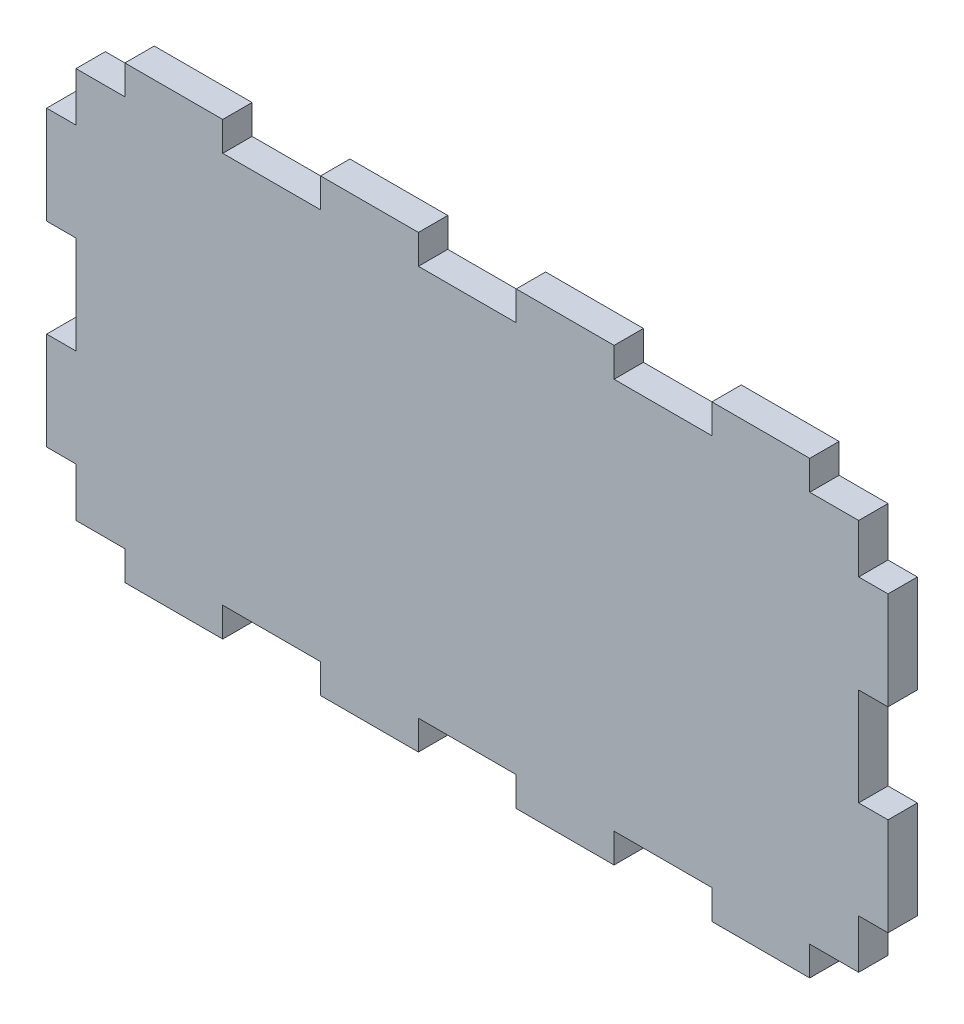
from build123d import *

# Parameters (mm, degrees)
EXTRUDE_1_DEPTH = 3


with BuildPart() as part:
    # 草图1 → 凸台-拉伸1 (new body)
    with BuildSketch(Plane.XY):
        Polygon((-15, -20), (-15, -23), (-5, -23), (-5, -20), (5, -20), (5, -23), (15, -23), (15, -20), (25, -20), (25, -23), (35, -23), (35, -20), (40, -20), (40, -15), (43, -15), (43, -5), (40, -5), (40, 5), (43, 5), (43, 15), (40, 15), (40, 20), (35, 20), (35, 23), (25, 23), (25, 20), (15, 20), (15, 23), (5, 23), (5, 20), (-5, 20), (-5, 23), (-15, 23), (-15, 20), (-25, 20), (-25, 23), (-35, 23), (-35, 20), (-40, 20), (-40, 15), (-43, 15), (-43, 5), (-40, 5), (-40, -5), (-43, -5), (-43, -15), (-40, -15), (-40, -20), (-35, -20), (-35, -23), (-25, -23), (-25, -20), align=None)
    extrude(amount=EXTRUDE_1_DEPTH)


solid = part.part
